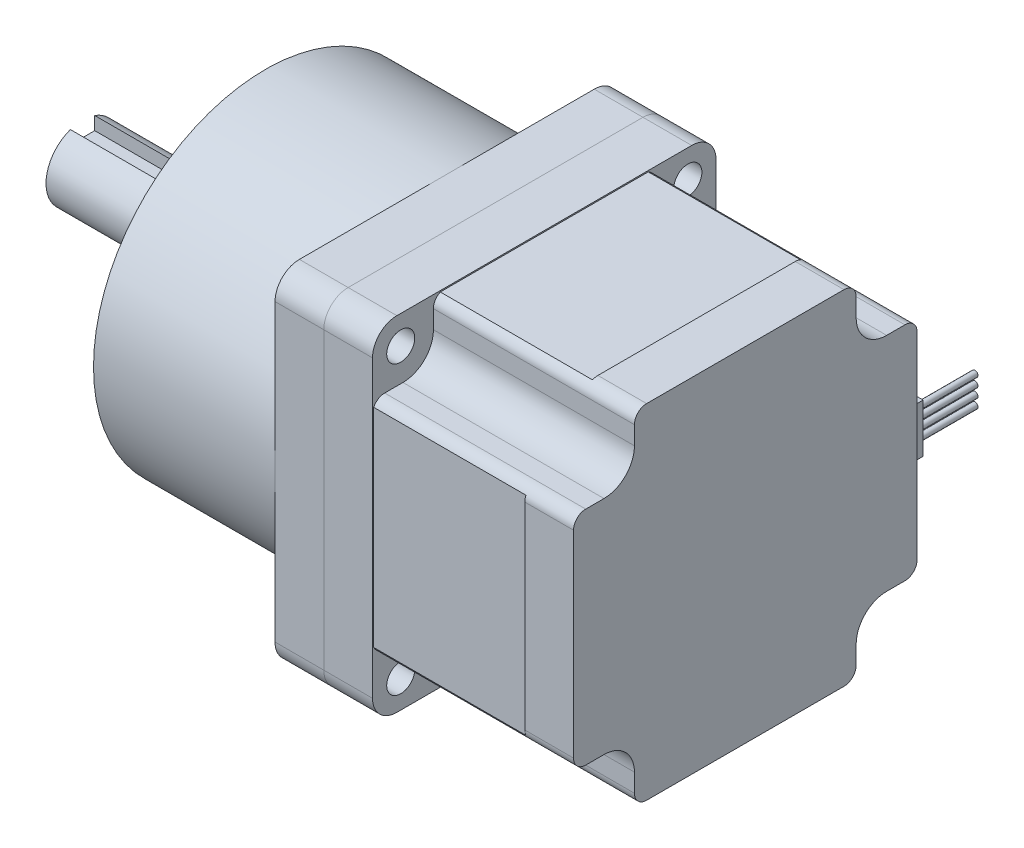
from build123d import *

# Parameters (mm, degrees)
SKETCH_1_W                  = 56.4
SKETCH_1_H                  = 56.4
EXTRUDE_1_DEPTH             = 20.5
SKETCH_7_W                  = 56.4
SKETCH_7_H                  = 56.4
SKETCH_7_W_2                = 56
SKETCH_7_H_2                = 56
CUT_EXTRUDE_1_DEPTH         = 12.5
SKETCH_2_R                  = 19.05
EXTRUDE_2_DEPTH             = 1.6
SKETCH_3_R                  = 3.175
EXTRUDE_3_DEPTH             = 19
SKETCH_10_W                 = 3
SKETCH_10_H                 = 8
EXTRUDE_4_DEPTH             = 3
SKETCH_11_R                 = 0.5
EXTRUDE_5_DEPTH             = 10
SKETCH_12_W                 = 10
SKETCH_12_H                 = 10
CUT_EXTRUDE_2_DEPTH         = 33
FILLET_2_R                  = 5
FILLET_3_R                  = 2
HOLE_WIZARD_4_6_4_6_1_D     = 4.6
HOLE_WIZARD_4_6_4_6_1_DEPTH = 10
HOLE_WIZARD_4_6_4_6_1_TIP   = 1.381979424
FILLET_1_R                  = 4
SKETCH_13_R                 = 2.3
EXTRUDE_6_DEPTH             = 8
SKETCH_14_R                 = 28.2
EXTRUDE_7_DEPTH             = 29.8
SKETCH_15_R                 = 16
EXTRUDE_8_DEPTH             = 2
SKETCH_16_R                 = 6
EXTRUDE_9_DEPTH             = 28
CUT_EXTRUDE_START           = 3.5
CUT_EXTRUDE_4_DEPTH         = 28
HOLE_WIZARD_M5_1_AT_2_COUNT = 2
HOLE_WIZARD_M5_1_AT_2_PITCH = 31.819805153
HOLE_WIZARD_M5_1_AT_3_COUNT = 2
HOLE_WIZARD_M5_1_AT_3_PITCH = 31.819805153
HOLE_WIZARD_M5_1_AT_4_COUNT = 2
HOLE_WIZARD_M5_1_AT_4_PITCH = 45


with BuildPart() as part:
    # 草图1 → 凸台-拉伸1 (new, symmetric)
    with BuildSketch(Plane(origin=(0, 0, 0), x_dir=(0, 0, -1), z_dir=(1, 0, 0))):
        Rectangle(SKETCH_1_W, SKETCH_1_H)
    extrude(amount=EXTRUDE_1_DEPTH, both=True)

    # 草图7 → 切除-拉伸1 (cut, symmetric)
    with BuildSketch(Plane(origin=(0, 0, 0), x_dir=(0, 0, -1), z_dir=(1, 0, 0))):
        Rectangle(SKETCH_7_W, SKETCH_7_H)
        Rectangle(SKETCH_7_W_2, SKETCH_7_H_2, mode=Mode.SUBTRACT)
    extrude(amount=CUT_EXTRUDE_1_DEPTH, both=True, mode=Mode.SUBTRACT)

    # 草图2 → 凸台-拉伸2 (add)
    with BuildSketch(Plane.ZY.offset(20.5)):
        with Locations(Location((0, 0, 0), (0, 0, 180))):
            Circle(SKETCH_2_R)
    extrude(amount=EXTRUDE_2_DEPTH)

    # 草图3 → 凸台-拉伸3 (add)
    with BuildSketch(Plane.ZY.offset(22.1)):
        Circle(SKETCH_3_R)
    extrude(amount=EXTRUDE_3_DEPTH)

    # 草图10 → 凸台-拉伸4 (add)
    with BuildSketch(Plane(origin=(0, 0, -28.2), x_dir=(-1, 0, 0), z_dir=(0, 0, -1))):
        with Locations((-17, 0)):
            Rectangle(SKETCH_10_W, SKETCH_10_H)
    extrude(amount=EXTRUDE_4_DEPTH)

    # 草图11 → 凸台-拉伸5 (add)
    with BuildSketch(Plane(origin=(0, 0, -31.2), x_dir=(-1, 0, 0), z_dir=(0, 0, -1))):
        with Locations(Location((-17, -2.5, 0), (0, 0, 180))):
            Circle(SKETCH_11_R)
        with Locations(Location((-17, -1, 0), (0, 0, 180))):
            Circle(SKETCH_11_R)
        with Locations(Location((-17, 0.5, 0), (0, 0, 180))):
            Circle(SKETCH_11_R)
        with Locations(Location((-17, 2, 0), (0, 0, 180))):
            Circle(SKETCH_11_R)
    extrude(amount=EXTRUDE_5_DEPTH)

    # 草图12 → 切除-拉伸2 (cut)
    with BuildSketch(Plane(origin=(20.5, 0, 0), x_dir=(0, 0, -1), z_dir=(1, 0, 0))):
        with Locations((23.2, -23.2)):
            Rectangle(SKETCH_12_W, SKETCH_12_H)
        with Locations((-23.2, -23.2)):
            Rectangle(SKETCH_12_W, SKETCH_12_H)
        with Locations((-23.2, 23.2)):
            Rectangle(SKETCH_12_W, SKETCH_12_H)
        with Locations((23.2, 23.2)):
            Rectangle(SKETCH_12_W, SKETCH_12_H)
    extrude(amount=-CUT_EXTRUDE_2_DEPTH, mode=Mode.SUBTRACT)

    # 圆角2
    fillet_2_edges = [part.edges().sort_by_distance(p)[0] for p in [
        (4, -18.2, 18.2),
        (4, 18.2, 18.2),
        (4, 18.2, -18.2),
        (4, -18.2, -18.2),
    ]]
    fillet(fillet_2_edges, radius=FILLET_2_R)

    # 圆角3
    fillet_3_edges = [part.edges().sort_by_distance(p)[0] for p in [
        (16.5, 28.2, -18.2),
        (16.5, 28.2, 18.2),
        (16.5, 18.2, 28.2),
        (16.5, -18.2, 28.2),
        (16.5, -28.2, 18.2),
        (16.5, -28.2, -18.2),
        (16.5, -18.2, -28.2),
        (16.5, 18.2, -28.2),
    ]]
    fillet(fillet_3_edges, radius=FILLET_3_R)

    # Ø4.6 (4.6) 直径孔1
    with Locations(Plane.ZY.offset(20.5)):
        with Locations((-23.57, 23.57), (23.57, 23.57), (23.57, -23.57), (-23.57, -23.57)):
            Hole(HOLE_WIZARD_4_6_4_6_1_D / 2, depth=HOLE_WIZARD_4_6_4_6_1_DEPTH)
            with Locations((0, 0, -(HOLE_WIZARD_4_6_4_6_1_DEPTH + HOLE_WIZARD_4_6_4_6_1_TIP / 2))):  # 118° drill point
                Cone(0, HOLE_WIZARD_4_6_4_6_1_D / 2, HOLE_WIZARD_4_6_4_6_1_TIP, mode=Mode.SUBTRACT)

    # 圆角1
    fillet_1_edges = [part.edges().sort_by_distance(p)[0] for p in [
        (-16.5, 28.2, 28.2),
        (-16.5, 28.2, -28.2),
        (-16.5, -28.2, -28.2),
        (-16.5, -28.2, 28.2),
    ]]
    fillet(fillet_1_edges, radius=FILLET_1_R)


with BuildPart() as body_2:
    # 草图13 → 凸台-拉伸6 (new body)
    with BuildSketch(Plane.ZY.offset(20.5)):
        with BuildLine():
            Line((-24.2, -28.2), (24.2, -28.2))
            ThreePointArc((24.2, -28.2), (27.028427125, -27.028427125), (28.2, -24.2))
            Line((28.2, -24.2), (28.2, 24.2))
            ThreePointArc((28.2, 24.2), (27.028427125, 27.028427125), (24.2, 28.2))
            Line((24.2, 28.2), (-24.2, 28.2))
            ThreePointArc((-24.2, 28.2), (-27.028427125, 27.028427125), (-28.2, 24.2))
            Line((-28.2, 24.2), (-28.2, -24.2))
            ThreePointArc((-28.2, -24.2), (-27.028427125, -27.028427125), (-24.2, -28.2))
        make_face()
        with Locations((-23.57, 23.57)):
            Circle(SKETCH_13_R, mode=Mode.SUBTRACT)
        with Locations((23.57, 23.57)):
            Circle(SKETCH_13_R, mode=Mode.SUBTRACT)
        with Locations((-23.57, -23.57)):
            Circle(SKETCH_13_R, mode=Mode.SUBTRACT)
        with Locations((23.57, -23.57)):
            Circle(SKETCH_13_R, mode=Mode.SUBTRACT)
    extrude(amount=EXTRUDE_6_DEPTH)

    # 草图14 → 凸台-拉伸7 (add)
    with BuildSketch(Plane.ZY.offset(28.5)):
        Circle(SKETCH_14_R)
    extrude(amount=EXTRUDE_7_DEPTH)

    # 草图15 → 凸台-拉伸8 (add)
    with BuildSketch(Plane.ZY.offset(58.3)):
        Circle(SKETCH_15_R)
    extrude(amount=EXTRUDE_8_DEPTH)

    # 草图16 → 凸台-拉伸9 (add)
    with BuildSketch(Plane.ZY.offset(60.3)):
        Circle(SKETCH_16_R)
    extrude(amount=EXTRUDE_9_DEPTH)

    # 草图17 → 切除-拉伸4 (cut)
    with BuildSketch(Plane(origin=(0, 0, 0), x_dir=(1, 0, 0), z_dir=(0, 1, 0)).offset(CUT_EXTRUDE_START)):
        with BuildLine():
            Line((-88.3, 2), (-70.3, 2))
            ThreePointArc((-70.3, 2), (-68.3, 0), (-70.3, -2))
            Line((-70.3, -2), (-88.3, -2))
            ThreePointArc((-88.3, -2), (-90.3, 0), (-88.3, 2))
        make_face()
    extrude(amount=CUT_EXTRUDE_4_DEPTH, mode=Mode.SUBTRACT)

    # 草图19 → M5 螺纹孔1 (revolve, cut)
    with BuildSketch(Plane(origin=(-58.3, 15.909902577, -15.909902577), x_dir=(0, 0, 1), z_dir=(0, 1, 0))):
        Polygon((0, 0), (0, 13.6618073), (2.1, 12.4), (2.1, 0), align=None)
    hole_wizard_m5_1 = revolve(axis=Axis((-64.65, 15.909902577, -15.909902577), (1, 0, 0)), mode=Mode.SUBTRACT)

    # M5 螺纹孔1 at 2: M5 螺纹孔1 ×2
    with Locations(*[(0, 0, i * HOLE_WIZARD_M5_1_AT_2_PITCH) for i in range(1, HOLE_WIZARD_M5_1_AT_2_COUNT)]):
        add(hole_wizard_m5_1, mode=Mode.SUBTRACT)

    # M5 螺纹孔1 at 3: M5 螺纹孔1 ×2
    with Locations(*[(0, -i * HOLE_WIZARD_M5_1_AT_3_PITCH, 0) for i in range(1, HOLE_WIZARD_M5_1_AT_3_COUNT)]):
        add(hole_wizard_m5_1, mode=Mode.SUBTRACT)

    # M5 螺纹孔1 at 4: M5 螺纹孔1 ×2
    with Locations(*[Vector(0, -0.7071067811865475, 0.7071067811865477) * (i * HOLE_WIZARD_M5_1_AT_4_PITCH) for i in range(1, HOLE_WIZARD_M5_1_AT_4_COUNT)]):
        add(hole_wizard_m5_1, mode=Mode.SUBTRACT)


solid = Compound([part.part, body_2.part])
